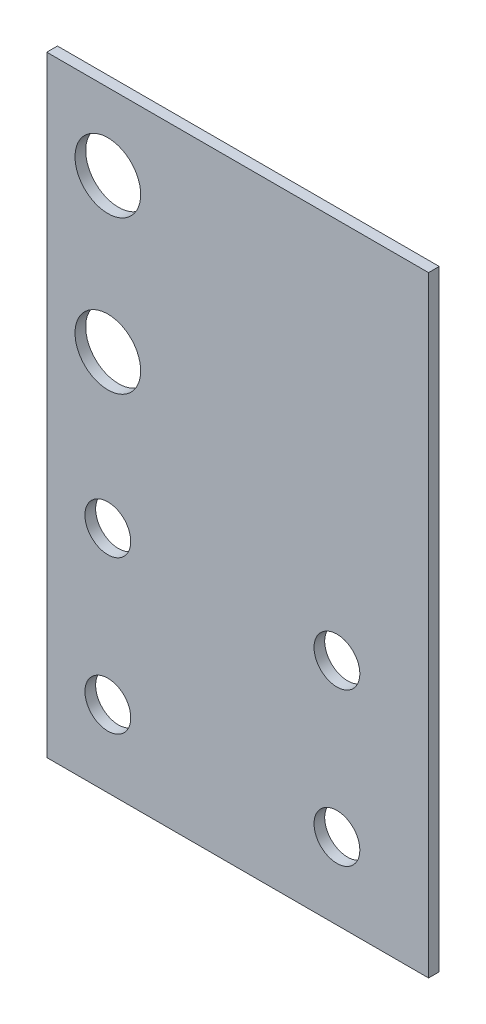
from build123d import *

# Parameters (mm, degrees)
SKETCH1_W           = 25
SKETCH1_H           = 0.7
BOSS_EXTRUDE1_DEPTH = 40
SKETCH2_R           = 2.15
SKETCH2_R_2         = 1.5
CUT_EXTRUDE1_DEPTH  = 40


with BuildPart() as part:
    # Sketch1 → Boss-Extrude1 (new body)
    with BuildSketch(Plane(origin=(0, 0, 0), x_dir=(1, 0, 0), z_dir=(0, 1, 0))):
        with Locations((12.5, 0.35)):
            Rectangle(SKETCH1_W, SKETCH1_H)
    extrude(amount=BOSS_EXTRUDE1_DEPTH)

    # Sketch2 → Cut-Extrude1 (cut)
    with BuildSketch(Plane.XY):
        with Locations((4, 35)):
            Circle(SKETCH2_R)
        with Locations((4, 25)):
            Circle(SKETCH2_R)
        with Locations((4, 15)):
            Circle(SKETCH2_R_2)
        with Locations((4, 5)):
            Circle(SKETCH2_R_2)
        with Locations((19, 15)):
            Circle(SKETCH2_R_2)
        with Locations((19, 5)):
            Circle(SKETCH2_R_2)
    extrude(amount=-CUT_EXTRUDE1_DEPTH, mode=Mode.SUBTRACT)


solid = part.part
